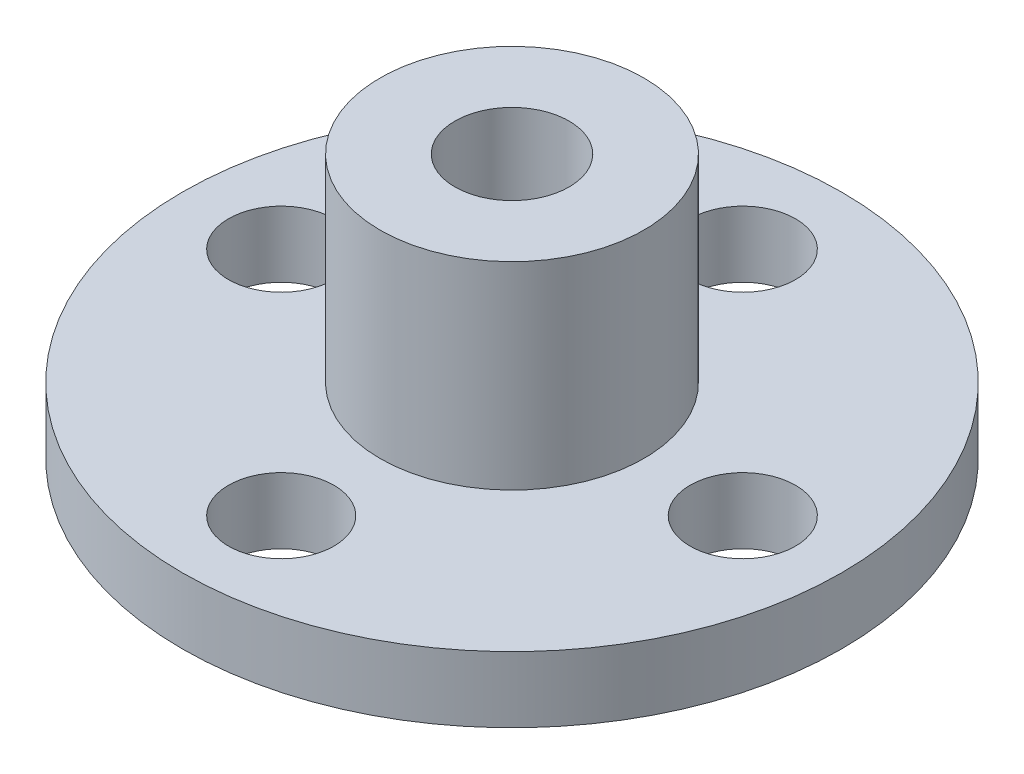
from build123d import *

# Parameters (mm, degrees)
SKETCH1_R           = 6.35
SKETCH1_R_2         = 2.75
BOSS_EXTRUDE1_DEPTH = 12.7
SKETCH2_R           = 15.875
SKETCH2_R_2         = 2.54
SKETCH2_R_3         = 6.35
BOSS_EXTRUDE2_DEPTH = 3.175


with BuildPart() as part:
    # Sketch1 → Boss-Extrude1 (new body)
    with BuildSketch(Plane(origin=(0, 0, 0), x_dir=(1, 0, 0), z_dir=(0, 1, 0))):
        with Locations(Location((0, 0, 0), (0, 0, 270))):
            Circle(SKETCH1_R)
        with Locations(Location((0, 0, 0), (0, 0, 270))):
            Circle(SKETCH1_R_2, mode=Mode.SUBTRACT)
    extrude(amount=BOSS_EXTRUDE1_DEPTH)

    # Sketch2 → Boss-Extrude2 (add)
    with BuildSketch(Plane.XZ):
        with Locations(Location((0, 0, 0), (0, 0, 270))):
            Circle(SKETCH2_R)
        with Locations(Location((0, 11.1125, 0), (0, 0, 270))):
            Circle(SKETCH2_R_2, mode=Mode.SUBTRACT)
        with Locations(Location((0, 0, 0), (0, 0, 270))):
            Circle(SKETCH2_R_3, mode=Mode.SUBTRACT)
        with Locations(Location((11.1125, 0, 0), (0, 0, 270))):
            Circle(SKETCH2_R_2, mode=Mode.SUBTRACT)
        with Locations(Location((0, -11.1125, 0), (0, 0, 270))):
            Circle(SKETCH2_R_2, mode=Mode.SUBTRACT)
        with Locations(Location((-11.1125, 0, 0), (0, 0, 270))):
            Circle(SKETCH2_R_2, mode=Mode.SUBTRACT)
    extrude(amount=-BOSS_EXTRUDE2_DEPTH)


solid = part.part
